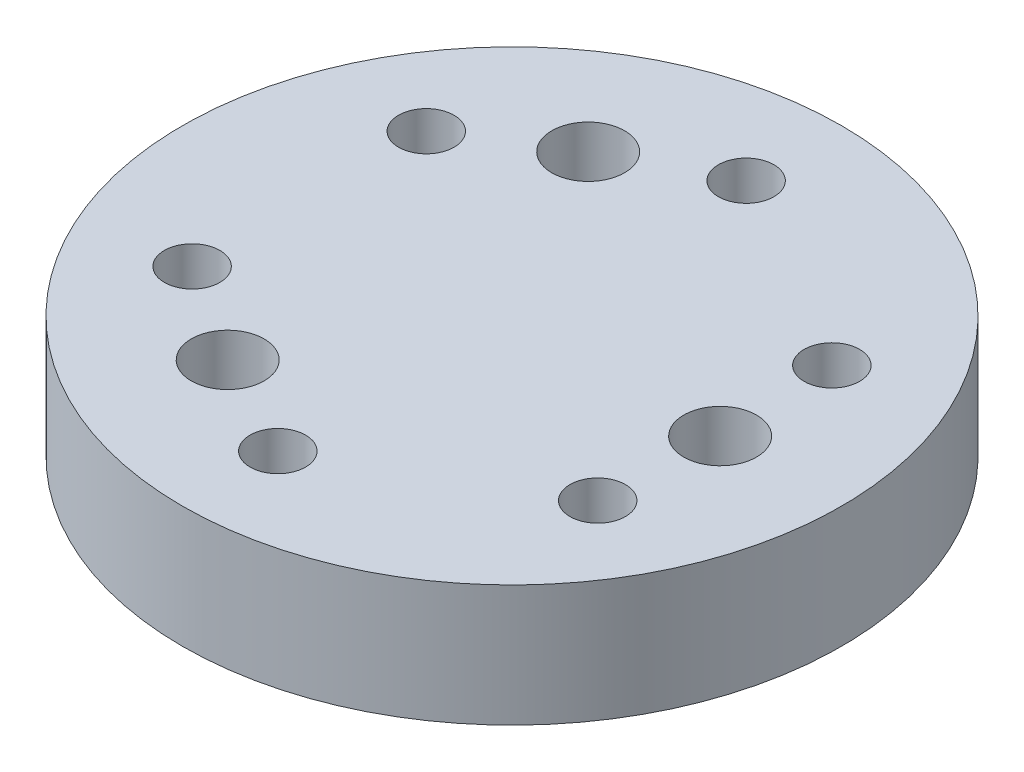
from build123d import *

# Parameters (mm, degrees)
SKETCH_1_R          = 19
SKETCH_1_R_2        = 17.6
EXTRUDE_1_DEPTH     = 3
SKETCH_2_R          = 19
EXTRUDE_2_DEPTH     = 4
SKETCH_3_R          = 1.6
SKETCH_3_R_2        = 2.1
CUT_EXTRUDE_1_DEPTH = 28.766886754


with BuildPart() as part:
    # 草图1 → 凸台-拉伸1 (new body)
    with BuildSketch(Plane(origin=(0, 0, 0), x_dir=(1, 0, 0), z_dir=(0, 1, 0))):
        with Locations(Location((0, 0, 0), (0, 0, 270))):
            Circle(SKETCH_1_R)
        with Locations(Location((0, 0, 0), (0, 0, 270))):
            Circle(SKETCH_1_R_2, mode=Mode.SUBTRACT)
    extrude(amount=EXTRUDE_1_DEPTH)

    # 草图2 → 凸台-拉伸2 (add)
    with BuildSketch(Plane(origin=(0, 3, 0), x_dir=(1, 0, 0), z_dir=(0, 1, 0))):
        with Locations(Location((0, 0, 0), (0, 0, 270))):
            Circle(SKETCH_2_R)
    extrude(amount=EXTRUDE_2_DEPTH)

    # 草图3 → 切除-拉伸1 (cut, through all)
    with BuildSketch(Plane(origin=(0, 7, 0), x_dir=(1, 0, 0), z_dir=(0, 1, 0))):
        with Locations(Location((0, 13.5, 0), (0, 0, 270))):
            Circle(SKETCH_3_R)
        with Locations(Location((11.691342951, 6.75, 0), (0, 0, 270))):
            Circle(SKETCH_3_R)
        with Locations(Location((11.691342951, -6.75, 0), (0, 0, 270))):
            Circle(SKETCH_3_R)
        with Locations(Location((0, -13.5, 0), (0, 0, 270))):
            Circle(SKETCH_3_R)
        with Locations(Location((-11.691342951, -6.75, 0), (0, 0, 270))):
            Circle(SKETCH_3_R)
        with Locations(Location((-11.691342951, 6.75, 0), (0, 0, 270))):
            Circle(SKETCH_3_R)
        with Locations(Location((12, 0, 0), (0, 0, 270))):
            Circle(SKETCH_3_R_2)
        with Locations(Location((-6, -10.392304845, 0), (0, 0, 270))):
            Circle(SKETCH_3_R_2)
        with Locations(Location((-6, 10.392304845, 0), (0, 0, 270))):
            Circle(SKETCH_3_R_2)
    extrude(amount=-CUT_EXTRUDE_1_DEPTH, mode=Mode.SUBTRACT)


solid = part.part
